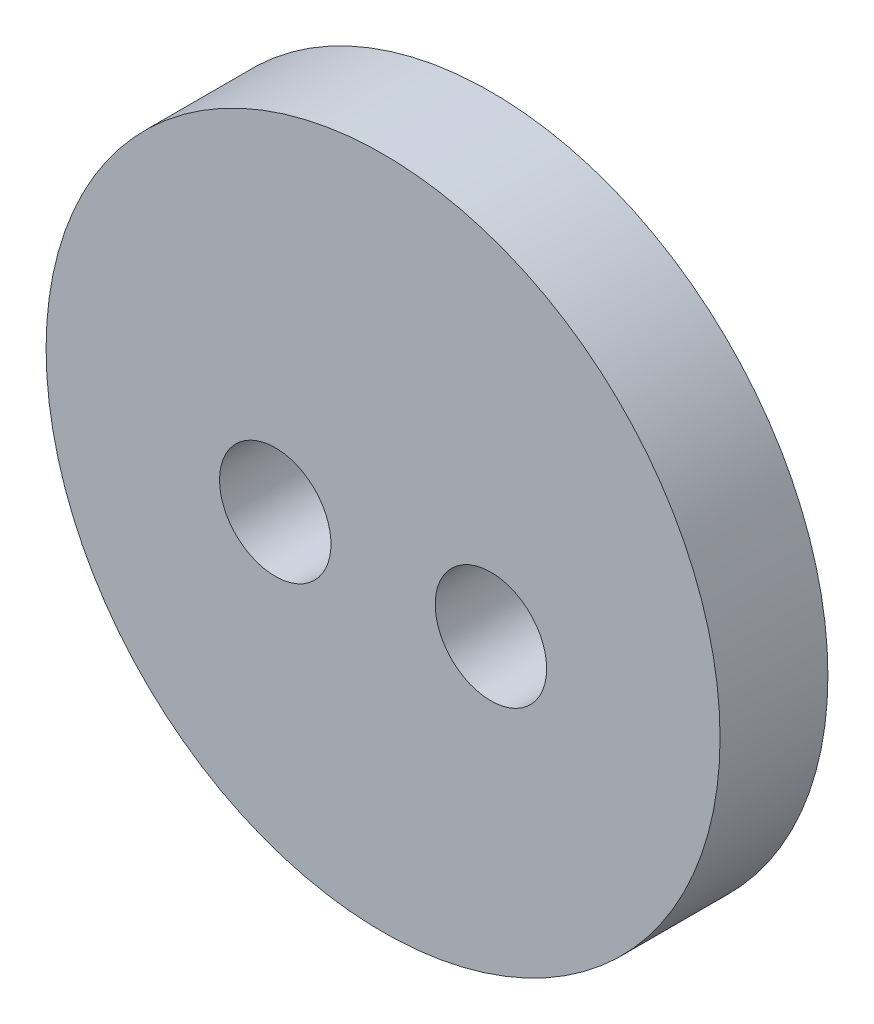
from build123d import *

# Parameters (mm, degrees)
SKETCH1_R           = 9.375
BOSS_EXTRUDE1_DEPTH = 3
SKETCH2_R           = 1.55
CUT_EXTRUDE1_DEPTH  = 14.59342672


with BuildPart() as part:
    # Sketch1 → Boss-Extrude1 (new body)
    with BuildSketch(Plane.XY):
        Circle(SKETCH1_R)
    extrude(amount=BOSS_EXTRUDE1_DEPTH)

    # Sketch2 → Cut-Extrude1 (cut, through all)
    with BuildSketch(Plane.XY.offset(3)):
        with Locations((3, -0.75)):
            Circle(SKETCH2_R)
        with Locations(Location((-3, -0.75, 0), (0, 0, 180))):
            Circle(SKETCH2_R)
    extrude(amount=-CUT_EXTRUDE1_DEPTH, mode=Mode.SUBTRACT)


solid = part.part
